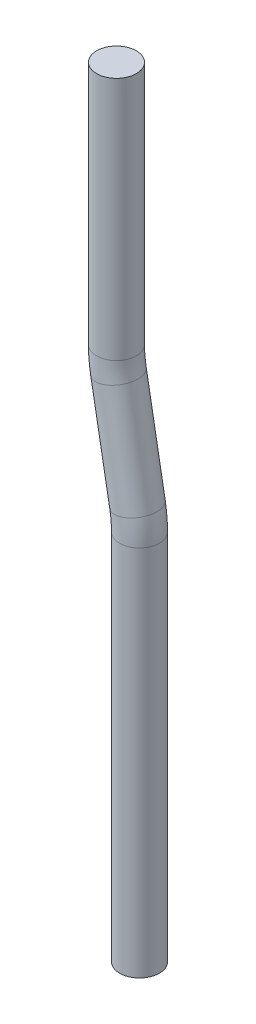
from build123d import *

# Parameters (mm, degrees)
SKETCH1_R = 3.937


with BuildPart() as part:
    # Sweep1: sweep along a path in Sketch2
    with BuildLine(Plane.XY) as sweep1_path:
        Line((0, 0), (0, -48.532222571))
        ThreePointArc((0, -48.532222571), (0.100635252, -50.791015025), (0.401743571, -53.031908728))
        Line((0.401743571, -53.031908728), (4.170256429, -73.968091272))
        ThreePointArc((4.170256429, -73.968091272), (4.471364748, -76.208984975), (4.572, -78.467777429))
        Line((4.572, -78.467777429), (4.572, -152.4))
    # Sketch1 → Sweep1 (sweep)
    with BuildSketch(Plane(origin=(0, 0, 0), x_dir=(1, 0, 0), z_dir=(0, 1, 0))):
        Circle(SKETCH1_R)
    sweep(path=sweep1_path.line)


solid = part.part
